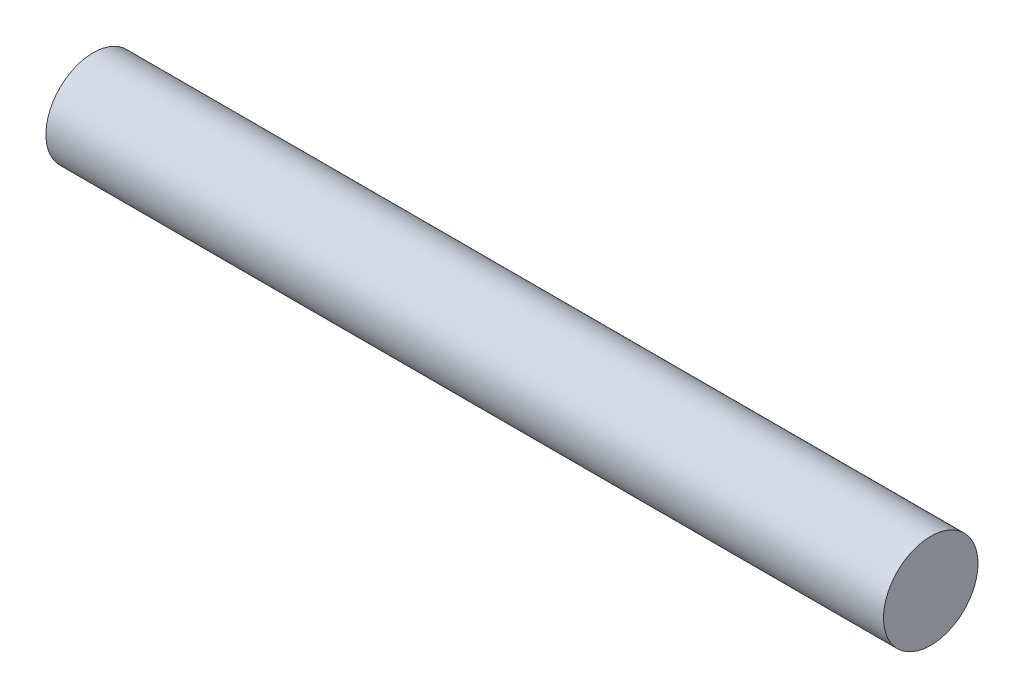
from build123d import *

# Parameters (mm, degrees)
SKETCH1_R           = 5
BOSS_EXTRUDE1_DEPTH = 88.6


with BuildPart() as part:
    # Sketch1 → Boss-Extrude1 (new body)
    with BuildSketch(Plane(origin=(0, 0, 0), x_dir=(0, 0, -1), z_dir=(1, 0, 0))):
        Circle(SKETCH1_R)
    extrude(amount=BOSS_EXTRUDE1_DEPTH)


solid = part.part
